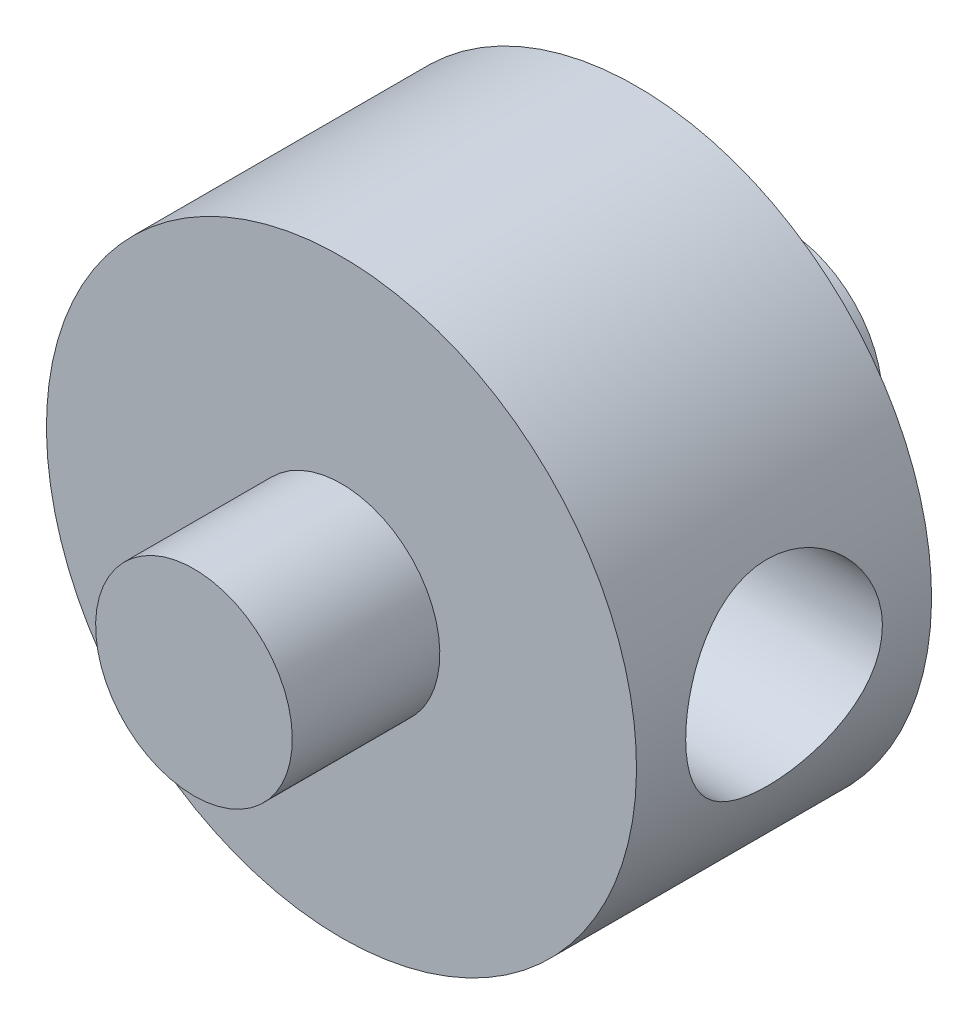
from build123d import *

# Parameters (mm, degrees)
CUT_EXTRUDE1_DEPTH      = 24.3313898
CUT_EXTRUDE1_DEPTH_BACK = 24.3313898
SKETCH2_R               = 3.175


with BuildPart() as part:
    # Sketch1 → Revolve1 (revolve)
    with BuildSketch(Plane(origin=(0, 0, 0), x_dir=(0, 0, -1), z_dir=(1, 0, 0)), mode=Mode.PRIVATE) as revolve1_sk:
        Polygon((0, 0), (19.05, 0), (19.05, 3.175), (14.2875, 3.175), (14.2875, 9.525), (4.7625, 9.525), (4.7625, 3.175), (0, 3.175), align=None)
    revolve(revolve1_sk.sketch.rotate(Axis((0, 0, 0), (0, 0, -1)), 180), axis=Axis((0, 0, 0), (0, 0, -1)))

    # Sketch2 → Cut-Extrude1 (cut, two sides: drawn at the far end of the back side and taken through both)
    with BuildSketch(Plane(origin=(0, 0, 0), x_dir=(0, 0, -1), z_dir=(1, 0, 0)).offset(-CUT_EXTRUDE1_DEPTH_BACK)):
        with Locations((9.525, 0)):
            Circle(SKETCH2_R)
    extrude(amount=CUT_EXTRUDE1_DEPTH + CUT_EXTRUDE1_DEPTH_BACK, mode=Mode.SUBTRACT)


solid = part.part
